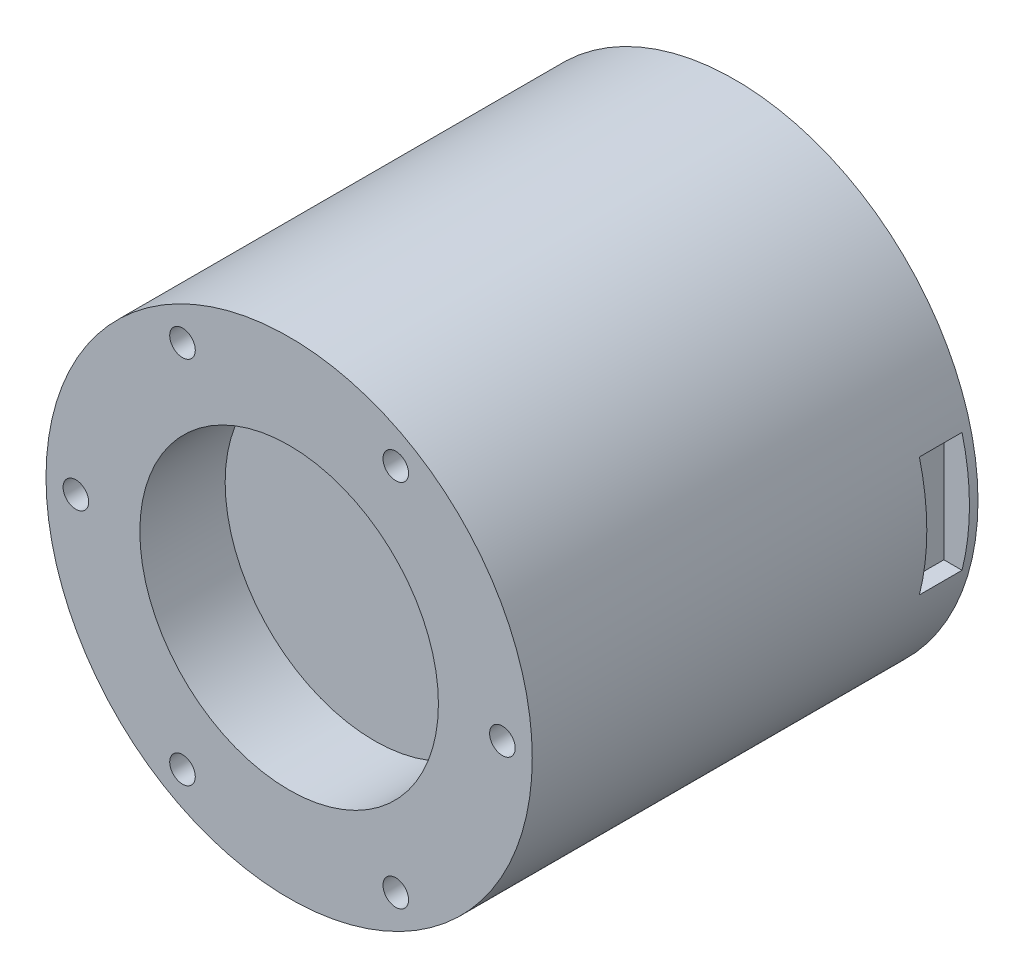
from build123d import *

# Parameters (mm, degrees)
SKETCH_1_R               = 28.5
EXTRUDE_1_DEPTH          = 52.25
SKETCH_2_R               = 1.5
CUT_EXTRUDE_1_DEPTH      = 5
PATTERN_CIRCULAR_1_COUNT = 6
SKETCH_3_R               = 17.5
CUT_EXTRUDE_2_DEPTH      = 10
CUT_EXTRUDE_START        = -1
CUT_EXTRUDE_5_DEPTH      = 5
CUT_EXTRUDE_6_DEPTH      = 8
SKETCH_8_R               = 1.5
CUT_EXTRUDE_8_DEPTH      = 4
PATTERN_CIRCULAR_2_COUNT = 4


with BuildPart() as part:
    # 草图1 → 凸台-拉伸1 (new body)
    with BuildSketch(Plane.XY):
        Circle(SKETCH_1_R)
    extrude(amount=EXTRUDE_1_DEPTH)

    # 草图2 → 切除-拉伸1 (cut)
    with BuildSketch(Plane.XY.offset(52.25)):
        with Locations((25, 0)):
            Circle(SKETCH_2_R)
    cut_extrude_1 = extrude(amount=-CUT_EXTRUDE_1_DEPTH, mode=Mode.SUBTRACT)

    # 阵列(圆周)1: 切除-拉伸1 ×6 about axis
    pattern_circular_1_axis = Axis((0, 0, 0), (0, 0, 1))
    for i in range(1, PATTERN_CIRCULAR_1_COUNT):
        add(cut_extrude_1.rotate(pattern_circular_1_axis, i * 360 / PATTERN_CIRCULAR_1_COUNT), mode=Mode.SUBTRACT)

    # 草图3 → 切除-拉伸2 (cut)
    with BuildSketch(Plane.XY.offset(52.25)):
        Circle(SKETCH_3_R)
    extrude(amount=-CUT_EXTRUDE_2_DEPTH, mode=Mode.SUBTRACT)

    # 草图5 → 切除-拉伸5 (cut)
    with BuildSketch(Plane(origin=(0, 0, 0), x_dir=(-1, 0, 0), z_dir=(0, 0, -1)).offset(CUT_EXTRUDE_START)):
        with BuildLine():
            ThreePointArc((28.5, 0), (28.280902723, 3.527115134), (27.626979567, 7))
            Line((27.626979567, 7), (25.5, 7))
            Line((25.5, 7), (25.5, -7))
            Line((25.5, -7), (27.626979567, -7))
            ThreePointArc((27.626979567, -7), (28.280902723, -3.527115134), (28.5, 0))
        make_face()
        with BuildLine():
            Line((-25.5, 7), (-27.626979567, 7))
            ThreePointArc((-27.626979567, 7), (-28.5, 0), (-27.626979567, -7))
            Line((-27.626979567, -7), (-25.5, -7))
            Line((-25.5, -7), (-25.5, 7))
        make_face()
    extrude(amount=-CUT_EXTRUDE_5_DEPTH, mode=Mode.SUBTRACT)

    # 草图7 → 切除-拉伸6 (cut)
    with BuildSketch(Plane(origin=(0, 0, 0), x_dir=(-1, 0, 0), z_dir=(0, 0, -1)).offset(CUT_EXTRUDE_START)):
        with BuildLine():
            Line((-4, -28.217902119), (-4, -25.5))
            Line((-4, -25.5), (4, -25.5))
            Line((4, -25.5), (4, -28.217902119))
            ThreePointArc((4, -28.217902119), (0, -28.5), (-4, -28.217902119))
        make_face()
    extrude(amount=-CUT_EXTRUDE_6_DEPTH, mode=Mode.SUBTRACT)

    # 草图8 → 切除-拉伸8 (cut)
    with BuildSketch(Plane(origin=(0, 0, 0), x_dir=(-1, 0, 0), z_dir=(0, 0, -1))):
        with Locations((13.435028843, 13.435028843)):
            Circle(SKETCH_8_R)
    cut_extrude_8 = extrude(amount=-CUT_EXTRUDE_8_DEPTH, mode=Mode.SUBTRACT)

    # 阵列(圆周)2: 切除-拉伸8 ×4 about axis
    pattern_circular_2_axis = Axis((0, 0, 0), (0, 0, 1))
    for i in range(1, PATTERN_CIRCULAR_2_COUNT):
        add(cut_extrude_8.rotate(pattern_circular_2_axis, i * 360 / PATTERN_CIRCULAR_2_COUNT), mode=Mode.SUBTRACT)


solid = part.part
